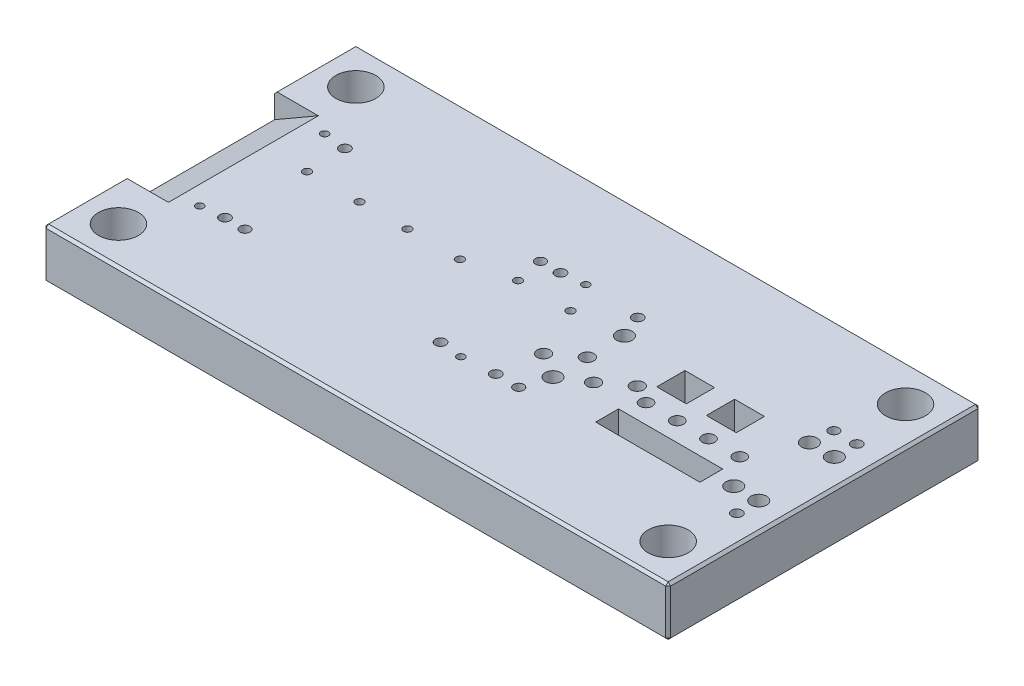
from build123d import *

# Parameters (mm, degrees)
SKETCH1_W                                           = 500
SKETCH1_H                                           = 250
BOSS_EXTRUDE1_DEPTH                                 = 40
F_32_0_32_DIAMETER_HOLE1_D                          = 32
CHAMFER1_SIZE                                       = 2
CBORE_FOR_M8_HEX_SOCKET_HEAD_CAP_SCREW1_D           = 8.4
CBORE_FOR_M8_HEX_SOCKET_HEAD_CAP_SCREW1_CBORE_D     = 15
CBORE_FOR_M8_HEX_SOCKET_HEAD_CAP_SCREW1_CBORE_DEPTH = 8.6
F_8_0MM_DOWEL_HOLE1_D                               = 8
SKETCH16_R                                          = 6.25
SKETCH16_R_2                                        = 5
CUT_EXTRUDE1_DEPTH                                  = 10
CUT_EXTRUDE2_REACH                                  = 284.356
SKETCH18_R                                          = 3
SKETCH19_R                                          = 5.5
CUT_EXTRUDE3_DEPTH                                  = 33
CBORE_FOR_M6_HEX_SOCKET_HEAD_CAP_SCREW1_D           = 6.4
CBORE_FOR_M6_HEX_SOCKET_HEAD_CAP_SCREW1_CBORE_D     = 11
CBORE_FOR_M6_HEX_SOCKET_HEAD_CAP_SCREW1_CBORE_DEPTH = 6.4
CUT_EXTRUDE4_REACH                                  = 284.356
SKETCH23_R                                          = 5.174550649
SKETCH23_W                                          = 83.404692778
SKETCH23_H                                          = 18.284692778
SKETCH23_W_2                                        = 23.904692778
SKETCH23_H_2                                        = 22.564692778
SKETCH23_W_3                                        = 23.654692778


with BuildPart() as part:
    # Sketch1 → Boss-Extrude1 (new body)
    with BuildSketch(Plane(origin=(0, 0, 0), x_dir=(1, 0, 0), z_dir=(0, 1, 0))):
        Rectangle(SKETCH1_W, SKETCH1_H)
    extrude(amount=-BOSS_EXTRUDE1_DEPTH)

    # Ø32.0 (32) Diameter Hole1 (through all)
    with Locations(Plane(origin=(0, 0, 0), x_dir=(1, 0, 0), z_dir=(0, 1, 0))):
        with Locations((-220, 95), (-220, -95), (220, -95), (220, 95)):
            Hole(F_32_0_32_DIAMETER_HOLE1_D / 2)

    # Chamfer1
    chamfer1_edges = [part.edges().sort_by_distance(p)[0] for p in [
        (-250, -40, 0),
        (0, -40, 125),
        (250, -40, 0),
        (0, 0, 125),
        (-250, 0, 0),
        (0, 0, -125),
        (250, 0, 0),
        (250, -20, 125),
        (-250, -20, 125),
        (-250, -20, -125),
        (250, -20, -125),
        (0, -40, -125),
    ]]
    chamfer(chamfer1_edges, length=CHAMFER1_SIZE)

    # CBORE for M8 Hex Socket Head Cap Screw1 (through all)
    with Locations(Plane(origin=(0, -40, 0), x_dir=(-1, 0, 0), z_dir=(0, -1, 0))):
        with Locations((-228, 48), (-52.632503002, 48), (-228, -48), (-35, -48), (9.219, 48), (181.75, 48), (181.75, -48), (9.219, -48)):
            CounterBoreHole(CBORE_FOR_M8_HEX_SOCKET_HEAD_CAP_SCREW1_D / 2, CBORE_FOR_M8_HEX_SOCKET_HEAD_CAP_SCREW1_CBORE_D / 2, CBORE_FOR_M8_HEX_SOCKET_HEAD_CAP_SCREW1_CBORE_DEPTH)

    # Ø8.0mm Dowel Hole1 (through all)
    with Locations(Plane(origin=(0, -40, 0), x_dir=(-1, 0, 0), z_dir=(0, -1, 0))):
        with Locations((-53.4, -48), (-209.6, 48), (25.219, 48), (165.75, -48)):
            Hole(F_8_0MM_DOWEL_HOLE1_D / 2)

    # Sketch16 → Cut-Extrude1 (cut)
    with BuildSketch(Plane(origin=(0, 0, 0), x_dir=(1, 0, 0), z_dir=(0, 1, 0))):
        with Locations(Location((60, 30, 0), (0, 0, 270))):
            Circle(SKETCH16_R)
        with Locations(Location((208, 30, 0), (0, 0, 270))):
            Circle(SKETCH16_R)
        with Locations(Location((228, 30, 0), (0, 0, 270))):
            Circle(SKETCH16_R)
        with Locations(Location((228, -30.5, 0), (0, 0, 270))):
            Circle(SKETCH16_R)
        with Locations(Location((208, -30.5, 0), (0, 0, 270))):
            Circle(SKETCH16_R)
        with Locations(Location((190, -7.72, 0), (0, 0, 270))):
            Circle(SKETCH16_R_2)
        with Locations(Location((165, -7.72, 0), (0, 0, 270))):
            Circle(SKETCH16_R_2)
        with Locations(Location((140, -7.72, 0), (0, 0, 270))):
            Circle(SKETCH16_R_2)
        with Locations(Location((115, -7.72, 0), (0, 0, 270))):
            Circle(SKETCH16_R_2)
        with Locations(Location((60, -27.22, 0), (0, 0, 270))):
            Circle(SKETCH16_R)
    extrude(amount=-CUT_EXTRUDE1_DEPTH, mode=Mode.SUBTRACT)

    # Sketch18 → Cut-Extrude2 (cut, up to next)
    with BuildSketch(Plane(origin=(0, 0, 0), x_dir=(1, 0, 0), z_dir=(0, 1, 0)), mode=Mode.PRIVATE) as cut_extrude2_sk1:
        with Locations(Location((-200, -50, 0), (0, 0, 270))):
            Circle(SKETCH18_R)
    cut_extrude2_tool1 = extrude(cut_extrude2_sk1.sketch, amount=-CUT_EXTRUDE2_REACH, mode=Mode.PRIVATE) & part.part
    # Sketch18 → Cut-Extrude2 (cut, up to next)
    with BuildSketch(Plane(origin=(0, 0, 0), x_dir=(1, 0, 0), z_dir=(0, 1, 0)), mode=Mode.PRIVATE) as cut_extrude2_sk2:
        with Locations(Location((-200, 50, 0), (0, 0, 270))):
            Circle(SKETCH18_R)
    cut_extrude2_tool2 = extrude(cut_extrude2_sk2.sketch, amount=-CUT_EXTRUDE2_REACH, mode=Mode.PRIVATE) & part.part
    # Sketch18 → Cut-Extrude2 (cut, up to next)
    with BuildSketch(Plane(origin=(0, 0, 0), x_dir=(1, 0, 0), z_dir=(0, 1, 0)), mode=Mode.PRIVATE) as cut_extrude2_sk3:
        with Locations(Location((9.031, 50, 0), (0, 0, 270))):
            Circle(SKETCH18_R)
    cut_extrude2_tool3 = extrude(cut_extrude2_sk3.sketch, amount=-CUT_EXTRUDE2_REACH, mode=Mode.PRIVATE) & part.part
    # Sketch18 → Cut-Extrude2 (cut, up to next)
    with BuildSketch(Plane(origin=(0, 0, 0), x_dir=(1, 0, 0), z_dir=(0, 1, 0)), mode=Mode.PRIVATE) as cut_extrude2_sk4:
        with Locations(Location((9.031, -50, 0), (0, 0, 270))):
            Circle(SKETCH18_R)
    cut_extrude2_tool4 = extrude(cut_extrude2_sk4.sketch, amount=-CUT_EXTRUDE2_REACH, mode=Mode.PRIVATE) & part.part
    add(cut_extrude2_tool1.solids().sort_by_distance((-200, 0, 50))[0], mode=Mode.SUBTRACT)
    add(cut_extrude2_tool2.solids().sort_by_distance((-200, 0, -50))[0], mode=Mode.SUBTRACT)
    add(cut_extrude2_tool3.solids().sort_by_distance((9.031, 0, -50))[0], mode=Mode.SUBTRACT)
    add(cut_extrude2_tool4.solids().sort_by_distance((9.031, 0, 50))[0], mode=Mode.SUBTRACT)

    # Sketch19 → Cut-Extrude3 (cut)
    with BuildSketch(Plane.XZ.offset(40)):
        with Locations(Location((-200, 50, 0), (0, 0, 270))):
            Circle(SKETCH19_R)
        with Locations(Location((-200, -50, 0), (0, 0, 270))):
            Circle(SKETCH19_R)
        with Locations(Location((9.031, -50, 0), (0, 0, 270))):
            Circle(SKETCH19_R)
        with Locations(Location((9.031, 50, 0), (0, 0, 270))):
            Circle(SKETCH19_R)
    extrude(amount=-CUT_EXTRUDE3_DEPTH, mode=Mode.SUBTRACT)

    # CBORE for M6 Hex Socket Head Cap Screw1 (through all)
    with Locations(Plane(origin=(0, -40, 0), x_dir=(-1, 0, 0), z_dir=(0, -1, 0))):
        with Locations((-21.125, 25.691000385), (20.875, 25.691000385), (58.875, 17.152366083), (100.875, 17.152366083), (138.875, 16.78), (180.875, 16.78)):
            CounterBoreHole(CBORE_FOR_M6_HEX_SOCKET_HEAD_CAP_SCREW1_D / 2, CBORE_FOR_M6_HEX_SOCKET_HEAD_CAP_SCREW1_CBORE_D / 2, CBORE_FOR_M6_HEX_SOCKET_HEAD_CAP_SCREW1_CBORE_DEPTH)

    # Sketch23 → Cut-Extrude4 (cut, up to next)
    with BuildSketch(Plane.XZ.offset(40), mode=Mode.PRIVATE) as cut_extrude4_sk1:
        with Locations(Location((100, -0.28, 0), (0, 0, 270))):
            Circle(SKETCH23_R)
    cut_extrude4_tool1 = extrude(cut_extrude4_sk1.sketch, amount=-CUT_EXTRUDE4_REACH, mode=Mode.PRIVATE) & part.part
    # Sketch23 → Cut-Extrude4 (cut, up to next)
    with BuildSketch(Plane.XZ.offset(40), mode=Mode.PRIVATE) as cut_extrude4_sk2:
        with Locations(Location((80, 14.72, 0), (0, 0, 270))):
            Circle(SKETCH23_R)
    cut_extrude4_tool2 = extrude(cut_extrude4_sk2.sketch, amount=-CUT_EXTRUDE4_REACH, mode=Mode.PRIVATE) & part.part
    # Sketch23 → Cut-Extrude4 (cut, up to next)
    with BuildSketch(Plane.XZ.offset(40), mode=Mode.PRIVATE) as cut_extrude4_sk3:
        with Locations(Location((60, -0.28, 0), (0, 0, 270))):
            Circle(SKETCH23_R)
    cut_extrude4_tool3 = extrude(cut_extrude4_sk3.sketch, amount=-CUT_EXTRUDE4_REACH, mode=Mode.PRIVATE) & part.part
    # Sketch23 → Cut-Extrude4 (cut, up to next)
    with BuildSketch(Plane.XZ.offset(40), mode=Mode.PRIVATE) as cut_extrude4_sk4:
        with Locations(Location((40, 14.72, 0), (0, 0, 270))):
            Circle(SKETCH23_R)
    cut_extrude4_tool4 = extrude(cut_extrude4_sk4.sketch, amount=-CUT_EXTRUDE4_REACH, mode=Mode.PRIVATE) & part.part
    # Sketch23 → Cut-Extrude4 (cut, up to next)
    with BuildSketch(Plane.XZ.offset(40), mode=Mode.PRIVATE) as cut_extrude4_sk5:
        with Locations((150, 32.16)):
            Rectangle(SKETCH23_W, SKETCH23_H)
    cut_extrude4_tool5 = extrude(cut_extrude4_sk5.sketch, amount=-CUT_EXTRUDE4_REACH, mode=Mode.PRIVATE) & part.part
    # Sketch23 → Cut-Extrude4 (cut, up to next)
    with BuildSketch(Plane.XZ.offset(40), mode=Mode.PRIVATE) as cut_extrude4_sk6:
        with Locations((160, -18.86)):
            Rectangle(SKETCH23_W_2, SKETCH23_H_2)
    cut_extrude4_tool6 = extrude(cut_extrude4_sk6.sketch, amount=-CUT_EXTRUDE4_REACH, mode=Mode.PRIVATE) & part.part
    # Sketch23 → Cut-Extrude4 (cut, up to next)
    with BuildSketch(Plane.XZ.offset(40), mode=Mode.PRIVATE) as cut_extrude4_sk7:
        with Locations((120.125, -18.86)):
            Rectangle(SKETCH23_W_3, SKETCH23_H_2)
    cut_extrude4_tool7 = extrude(cut_extrude4_sk7.sketch, amount=-CUT_EXTRUDE4_REACH, mode=Mode.PRIVATE) & part.part
    add(cut_extrude4_tool1.solids().sort_by_distance((100, -40, -0.28))[0], mode=Mode.SUBTRACT)
    add(cut_extrude4_tool2.solids().sort_by_distance((80, -40, 14.72))[0], mode=Mode.SUBTRACT)
    add(cut_extrude4_tool3.solids().sort_by_distance((60, -40, -0.28))[0], mode=Mode.SUBTRACT)
    add(cut_extrude4_tool4.solids().sort_by_distance((40, -40, 14.72))[0], mode=Mode.SUBTRACT)
    add(cut_extrude4_tool5.solids().sort_by_distance((150, -40, 32.16))[0], mode=Mode.SUBTRACT)
    add(cut_extrude4_tool6.solids().sort_by_distance((160, -40, -18.86))[0], mode=Mode.SUBTRACT)
    add(cut_extrude4_tool7.solids().sort_by_distance((120.125, -40, -18.86))[0], mode=Mode.SUBTRACT)

    # Cut-Sweep1: sweep along a path in Sketch24
    with BuildLine(Plane(origin=(0, 0, 0), x_dir=(1, 0, 0), z_dir=(0, 1, 0))) as cut_sweep1_path:
        Line((-215, -60), (-215, 60))
    # Sketch25 → Cut-Sweep1 (sweep, cut)
    with BuildSketch(Plane.XY):
        Polygon((-215, 0), (-250, -20.207259422), (-250, 0), align=None)
    sweep(path=cut_sweep1_path.line, mode=Mode.SUBTRACT)


solid = part.part
